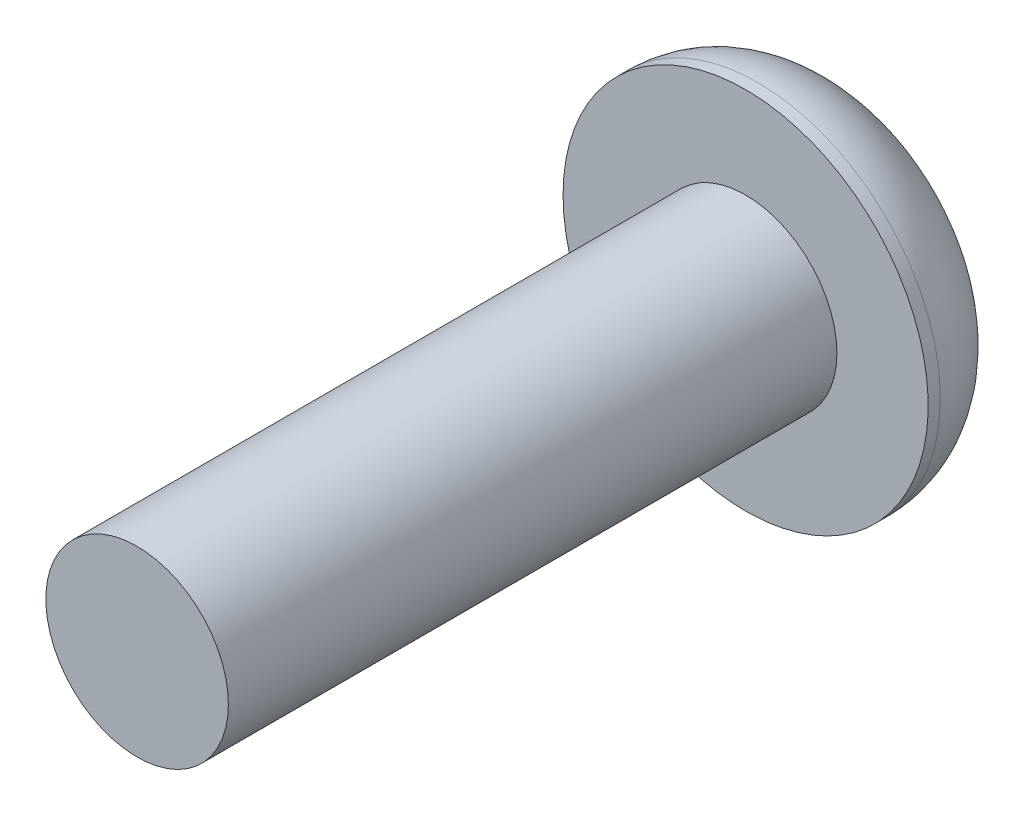
from build123d import *

# Parameters (mm, degrees)
SKETCH_1_R      = 1.5
EXTRUDE_1_DEPTH = 10
SKETCH_2_R      = 3
EXTRUDE_2_DEPTH = 1.7
FILLET_1_R      = 1.5


with BuildPart() as part:
    # 草图1 → 凸台-拉伸1 (new body)
    with BuildSketch(Plane.XY):
        Circle(SKETCH_1_R)
    extrude(amount=EXTRUDE_1_DEPTH)

    # 草图2 → 凸台-拉伸2 (add)
    with BuildSketch(Plane(origin=(0, 0, 0), x_dir=(-1, 0, 0), z_dir=(0, 0, -1))):
        Circle(SKETCH_2_R)
    extrude(amount=EXTRUDE_2_DEPTH)

    # 圆角1
    fillet_1_edges = [part.edges().sort_by_distance(p)[0] for p in [
        (3, 0, -1.7),
    ]]
    fillet(fillet_1_edges, radius=FILLET_1_R)


solid = part.part
